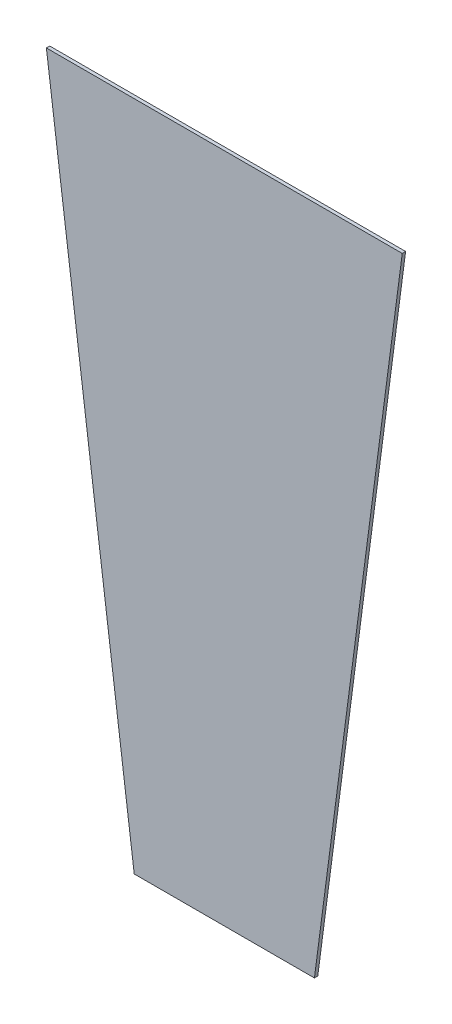
from build123d import *

# Parameters (mm, degrees)
SKETCH1_W           = 212
SKETCH1_H           = 400
BOSS_EXTRUDE1_DEPTH = 2
CUT_EXTRUDE1_DEPTH  = 227.362541071


with BuildPart() as part:
    # Sketch1 → Boss-Extrude1 (new body)
    with BuildSketch(Plane.XY):
        Rectangle(SKETCH1_W, SKETCH1_H)
    extrude(amount=BOSS_EXTRUDE1_DEPTH)

    # Sketch2 → Cut-Extrude1 (cut, through all)
    with BuildSketch(Plane(origin=(0, 0, 0), x_dir=(-1, 0, 0), z_dir=(0, 0, -1))):
        Polygon((53.675116484, -200), (106, 200), (106, -200), align=None)
        Polygon((-106, -200), (-53.675116484, -200), (-106, 200), align=None)
    extrude(amount=-CUT_EXTRUDE1_DEPTH, mode=Mode.SUBTRACT)


solid = part.part
